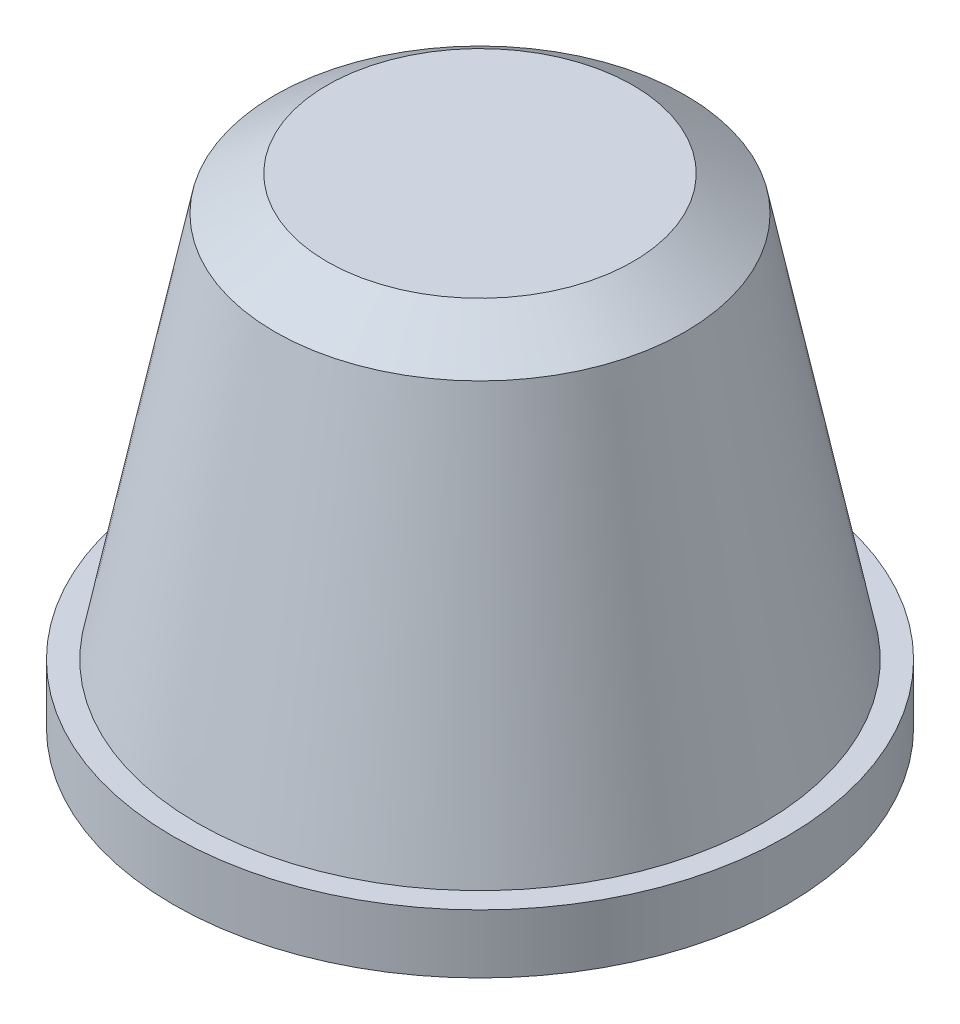
from build123d import *

# Parameters (mm, degrees)
CHAMFER1_SIZE  = 3
CHAMFER1_SIZE2 = 3.8333050077869637


with BuildPart() as part:
    # Sketch3 → Revolve1 (revolve)
    with BuildSketch(Plane.XY, mode=Mode.PRIVATE) as revolve1_sk:
        Polygon((-6.858044589676881, -0.3614112237926669), (-32.858044589676894, -0.36141122379267), (-32.858044589676894, 4.63858877620733), (-30.858044589676894, 4.63858877620733), (-25.010635386731394, 33.63858877620733), (-23.659461496582075, 40.33968347547897), (-6.858044589676881, 40.339683475478964), align=None)
    revolve(revolve1_sk.sketch.rotate(Axis((-6.858044589676881, 40.339683475478964, 0), (0, -1, 0)), 270), axis=Axis((-6.858044589676881, 40.339683475478964, 0), (0, -1, 0)))

    # Chamfer1
    chamfer1_edges = [part.edges().sort_by_distance(p)[0] for p in [
        (-6.8580445896768865, 40.33968347547897, -16.801416906905196),
    ]]
    chamfer1_side = [part.faces().sort_by_distance(p)[0] for p in [
        (-6.858044589676888, 22.489136125843153, -20.400708453452605),
    ]]
    chamfer(chamfer1_edges, length=CHAMFER1_SIZE, length2=CHAMFER1_SIZE2, reference=chamfer1_side[0])


solid = part.part
